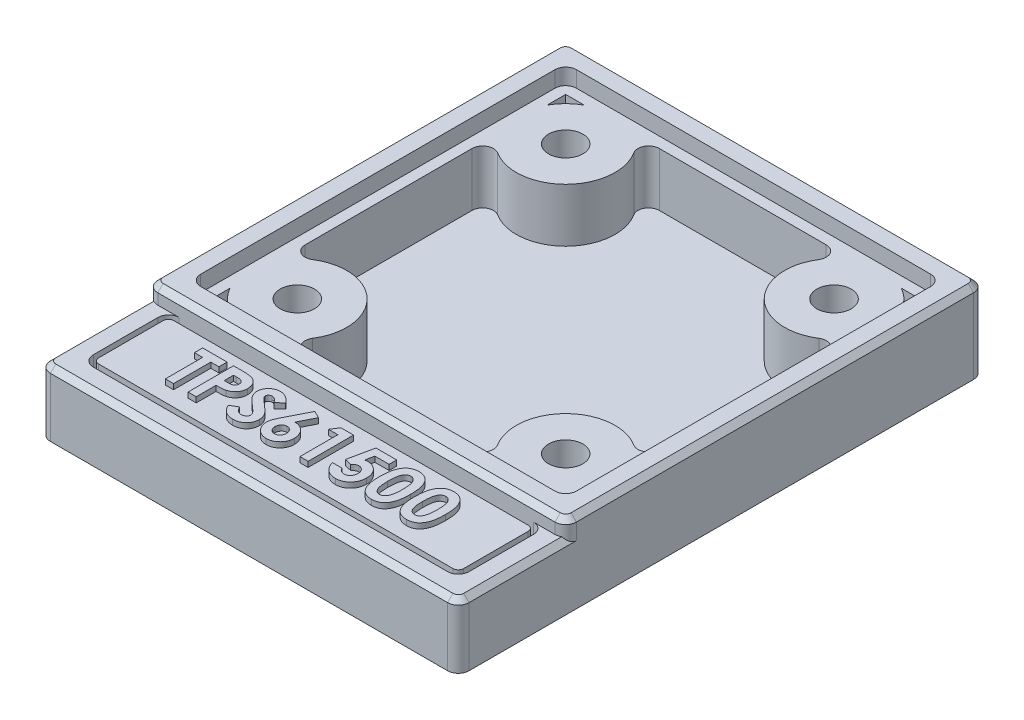
from build123d import *

# Parameters (mm, degrees)
SKETCH3_W           = 39
SKETCH3_H           = 39
SKETCH3_W_2         = 35
SKETCH3_H_2         = 35
SKETCH3_W_3         = 33
SKETCH3_H_3         = 33
SKETCH3_H_4         = 8
BOSS_EXTRUDE1_DEPTH = 1
BOSS_EXTRUDE2_START = 1
SKETCH3_3_W         = 39
SKETCH3_3_H         = 39
SKETCH3_3_W_2       = 35
SKETCH3_3_H_2       = 35
SKETCH3_3_W_3       = 33
SKETCH3_3_H_3       = 33
BOSS_EXTRUDE2_DEPTH = 5
BOSS_EXTRUDE3_START = 6
SKETCH3_4_W         = 39
SKETCH3_4_H         = 39
SKETCH3_4_W_2       = 35
SKETCH3_4_H_2       = 35
BOSS_EXTRUDE3_DEPTH = 1.5
SKETCH4_R           = 1.6
BOSS_EXTRUDE4_DEPTH = 5
FILLET1_R           = 1
CHAMFER1_SIZE       = 0.5
BOSS_EXTRUDE5_START = 0.5
BOSS_EXTRUDE5_DEPTH = 4.5
BOSS_EXTRUDE6_DEPTH = 0.5


with BuildPart() as part:
    # Sketch3 → Boss-Extrude1 (new body)
    # profile 1 of 5: a face of its own
    with BuildSketch(Plane(origin=(0, 0, 0), x_dir=(1, 0, 0), z_dir=(0, 1, 0))):
        Rectangle(SKETCH3_W, SKETCH3_H)
        Rectangle(SKETCH3_W_2, SKETCH3_H_2, mode=Mode.SUBTRACT)
    # profile 2 of 5: a face of its own
    with BuildSketch(Plane(origin=(0, 0, 0), x_dir=(1, 0, 0), z_dir=(0, 1, 0))):
        Rectangle(SKETCH3_W_2, SKETCH3_H_2)
        Rectangle(SKETCH3_W_3, SKETCH3_H_3, mode=Mode.SUBTRACT)
    # profile 3 of 5: a face of its own
    with BuildSketch(Plane(origin=(0, 0, 0), x_dir=(1, 0, 0), z_dir=(0, 1, 0))):
        Rectangle(SKETCH3_W_3, SKETCH3_H_3)
    # profile 4 of 5: a face of its own
    with BuildSketch(Plane(origin=(0, 0, 0), x_dir=(1, 0, 0), z_dir=(0, 1, 0))):
        Polygon((-17.5, -19.5), (-19.5, -19.5), (-19.5, -29.5), (19.5, -29.5), (19.5, -19.5), (17.5, -19.5), (17.5, -27.5), (-17.5, -27.5), align=None)
    # profile 5 of 5: a face of its own
    with BuildSketch(Plane(origin=(0, 0, 0), x_dir=(1, 0, 0), z_dir=(0, 1, 0))):
        with Locations((0, -23.5)):
            Rectangle(SKETCH3_W_2, SKETCH3_H_4)
    extrude(amount=BOSS_EXTRUDE1_DEPTH)

    # Sketch3<3> → Boss-Extrude2 (add)
    # profile 1 of 3: a face of its own
    with BuildSketch(Plane(origin=(0, 0, 0), x_dir=(1, 0, 0), z_dir=(0, 1, 0)).offset(BOSS_EXTRUDE2_START)):
        Polygon((-17.5, -19.5), (-19.5, -19.5), (-19.5, -29.5), (19.5, -29.5), (19.5, -19.5), (17.5, -19.5), (17.5, -27.5), (-17.5, -27.5), align=None)
    # profile 2 of 3: a face of its own
    with BuildSketch(Plane(origin=(0, 0, 0), x_dir=(1, 0, 0), z_dir=(0, 1, 0)).offset(BOSS_EXTRUDE2_START)):
        Rectangle(SKETCH3_3_W, SKETCH3_3_H)
        Rectangle(SKETCH3_3_W_2, SKETCH3_3_H_2, mode=Mode.SUBTRACT)
    # profile 3 of 3: a face of its own
    with BuildSketch(Plane(origin=(0, 0, 0), x_dir=(1, 0, 0), z_dir=(0, 1, 0)).offset(BOSS_EXTRUDE2_START)):
        Rectangle(SKETCH3_3_W_2, SKETCH3_3_H_2)
        Rectangle(SKETCH3_3_W_3, SKETCH3_3_H_3, mode=Mode.SUBTRACT)
    extrude(amount=BOSS_EXTRUDE2_DEPTH)

    # Sketch3<4> → Boss-Extrude3 (add)
    with BuildSketch(Plane(origin=(0, 0, 0), x_dir=(1, 0, 0), z_dir=(0, 1, 0)).offset(BOSS_EXTRUDE3_START)):
        Rectangle(SKETCH3_4_W, SKETCH3_4_H)
        Rectangle(SKETCH3_4_W_2, SKETCH3_4_H_2, mode=Mode.SUBTRACT)
    extrude(amount=BOSS_EXTRUDE3_DEPTH)

    # Sketch4 → Boss-Extrude4 (add)
    # profile 1 of 4: a face of its own
    with BuildSketch(Plane(origin=(0, 1, 0), x_dir=(1, 0, 0), z_dir=(0, 1, 0))):
        with BuildLine():
            ThreePointArc((-7.9, 12.5), (-8.524500575, 14.814174652), (-10.228436662, 16.5))
            Line((-10.228436662, 16.5), (-14.771563338, 16.5))
            ThreePointArc((-14.771563338, 16.5), (-15.752691193, 15.752691193), (-16.5, 14.771563338))
            Line((-16.5, 14.771563338), (-16.5, 10.228436662))
            ThreePointArc((-16.5, 10.228436662), (-11.325265988, 8.052528808), (-7.9, 12.5))
        make_face()
        with Locations(Location((-12.5, 12.5, 0), (0, 0, 90))):
            Circle(SKETCH4_R, mode=Mode.SUBTRACT)
    # profile 2 of 4: a face of its own
    with BuildSketch(Plane(origin=(0, 1, 0), x_dir=(1, 0, 0), z_dir=(0, 1, 0))):
        with BuildLine():
            ThreePointArc((16.5, 14.771563338), (15.752691193, 15.752691193), (14.771563338, 16.5))
            Line((14.771563338, 16.5), (10.228436662, 16.5))
            ThreePointArc((10.228436662, 16.5), (9.247308807, 9.247308807), (16.5, 10.228436662))
            Line((16.5, 10.228436662), (16.5, 14.771563338))
        make_face()
        with Locations(Location((12.5, 12.5, 0), (0, 0, 90))):
            Circle(SKETCH4_R, mode=Mode.SUBTRACT)
    # profile 3 of 4: a face of its own
    with BuildSketch(Plane(origin=(0, 1, 0), x_dir=(1, 0, 0), z_dir=(0, 1, 0))):
        with BuildLine():
            Line((16.5, -14.771563338), (16.5, -10.228436662))
            ThreePointArc((16.5, -10.228436662), (9.247308807, -9.247308807), (10.228436662, -16.5))
            Line((10.228436662, -16.5), (14.771563338, -16.5))
            ThreePointArc((14.771563338, -16.5), (15.752691193, -15.752691193), (16.5, -14.771563338))
        make_face()
        with Locations(Location((12.5, -12.5, 0), (0, 0, 90))):
            Circle(SKETCH4_R, mode=Mode.SUBTRACT)
    # profile 4 of 4: a face of its own
    with BuildSketch(Plane(origin=(0, 1, 0), x_dir=(1, 0, 0), z_dir=(0, 1, 0))):
        with BuildLine():
            Line((-14.771563338, -16.5), (-10.228436662, -16.5))
            ThreePointArc((-10.228436662, -16.5), (-8.524500575, -14.814174652), (-7.9, -12.5))
            ThreePointArc((-7.9, -12.5), (-11.325265988, -8.052528808), (-16.5, -10.228436662))
            Line((-16.5, -10.228436662), (-16.5, -14.771563338))
            ThreePointArc((-16.5, -14.771563338), (-15.752691193, -15.752691193), (-14.771563338, -16.5))
        make_face()
        with Locations(Location((-12.5, -12.5, 0), (0, 0, 90))):
            Circle(SKETCH4_R, mode=Mode.SUBTRACT)
    extrude(amount=BOSS_EXTRUDE4_DEPTH)

    # Fillet1
    fillet1_edges = [part.edges().sort_by_distance(p)[0] for p in [
        (19.5, 3.75, -19.5),
        (10.228436662, 3.5, -16.5),
        (16.5, 3.5, -10.228436662),
        (16.5, 3.5, 10.228436662),
        (10.228436662, 3.5, 16.5),
        (-16.5, 3.5, 10.228436662),
        (-10.228436662, 3.5, 16.5),
        (17.5, 3.5, 19.5),
        (-17.5, 3.5, 19.5),
        (-17.5, 3.5, 27.5),
        (17.5, 3.5, 27.5),
        (19.5, 6.75, 19.5),
        (-19.5, 6.75, 19.5),
        (17.5, 6.75, -17.5),
        (-17.5, 6.75, -17.5),
        (-17.5, 6.75, 17.5),
        (17.5, 6.75, 17.5),
        (-16.5, 3.5, -10.228436662),
        (-10.228436662, 3.5, -16.5),
        (19.5, 3, 29.5),
        (-19.5, 3, 29.5),
        (-19.5, 3.75, -19.5),
    ]]
    fillet(fillet1_edges, radius=FILLET1_R)

    # Chamfer1
    chamfer1_edges = [part.edges().sort_by_distance(p)[0] for p in [
        (0, 7.5, 19.5),
        (19.5, 7.5, 0),
        (0, 6, 29.5),
        (-19.5, 6, 23.5),
        (-19.207106781, 6, 29.207106781),
        (19.207106781, 6, 29.207106781),
        (-19.5, 7.5, 0),
        (0, 7.5, -19.5),
        (19.207106781, 7.5, -19.207106781),
        (-19.207106781, 7.5, -19.207106781),
        (-19.207106781, 7.5, 19.207106781),
        (19.207106781, 7.5, 19.207106781),
        (19.5, 6, 23.5),
    ]]
    chamfer(chamfer1_edges, length=CHAMFER1_SIZE)


with BuildPart() as body_2:
    # Sketch5 → Boss-Extrude5 (new body)
    with BuildSketch(Plane(origin=(0, 1, 0), x_dir=(1, 0, 0), z_dir=(0, 1, 0)).offset(BOSS_EXTRUDE5_START)):
        with BuildLine():
            Line((-17, -20.5), (-17, -26.5))
            ThreePointArc((-17, -26.5), (-16.853553391, -26.853553391), (-16.5, -27))
            Line((-16.5, -27), (16.5, -27))
            ThreePointArc((16.5, -27), (16.853553391, -26.853553391), (17, -26.5))
            Line((17, -26.5), (17, -20.5))
            ThreePointArc((17, -20.5), (16.853553391, -20.146446609), (16.5, -20))
            Line((16.5, -20), (-16.5, -20))
            ThreePointArc((-16.5, -20), (-16.853553391, -20.146446609), (-17, -20.5))
        make_face()
    extrude(amount=BOSS_EXTRUDE5_DEPTH)

    # Sketch6 → Boss-Extrude6 (add)
    # profile 1 of 8: a face of its own
    with BuildSketch(Plane(origin=(0, 6, 0), x_dir=(1, 0, 0), z_dir=(0, 1, 0))):
        Polygon((-12.455769231, -21.362535969), (-10.176282051, -21.362535969), (-10.176282051, -22.122365029), (-10.936111111, -22.122365029), (-10.936111111, -25.595869302), (-11.695940171, -25.595869302), (-11.695940171, -22.122365029), (-12.455769231, -22.122365029), align=None)
    # profile 2 of 8: a face of its own
    with BuildSketch(Plane(origin=(0, 6, 0), x_dir=(1, 0, 0), z_dir=(0, 1, 0))):
        with BuildLine():
            Line((-9.579273504, -21.362535969), (-8.73125, -21.362535969))
            add(Edge.make_bspline(
                [(-8.73125, -21.362535969), (-8.675841244, -21.36278399), (-8.56894614, -21.363262476), (-8.414794606, -21.369064746), (-8.272582267, -21.379462767), (-8.142341798, -21.392313077), (-8.02412675, -21.410328711), (-7.917789082, -21.430982225), (-7.823306727, -21.456144217), (-7.739614256, -21.486011152), (-7.664502966, -21.521223102), (-7.59342346, -21.558726342), (-7.527982143, -21.603485136), (-7.464875994, -21.650675571), (-7.407712899, -21.704805733), (-7.352926684, -21.762273179), (-7.302837694, -21.825357021), (-7.257213834, -21.893293647), (-7.215825964, -21.964827879), (-7.179666751, -22.040087597), (-7.150336423, -22.119191894), (-7.125731925, -22.201629053), (-7.105969352, -22.287395483), (-7.092814754, -22.377018654), (-7.08387949, -22.469872783), (-7.083091076, -22.533069362), (-7.082692308, -22.565033298)],
                knots=[0, 0, 0, 0, 1.698747864, 3.27724071, 4.728299578, 6.070144658, 7.288476769, 8.393259625, 9.389771311, 10.283485332, 11.113357557, 11.931608583, 12.74405601, 13.541433047, 14.344816069, 15.154114104, 15.974336324, 16.810834471, 17.661136416, 18.50621059, 19.367396281, 20.244825668, 21.142564693, 22.063065223, 23.020325768, 24, 24, 24, 24], degree=3))
            add(Edge.make_bspline(
                [(-7.082692308, -22.565033298), (-7.083269276, -22.60039424), (-7.084403089, -22.669882836), (-7.095518112, -22.771744592), (-7.114506084, -22.868860554), (-7.13932237, -22.962049719), (-7.173926916, -23.049778917), (-7.213460985, -23.134141395), (-7.262100429, -23.212771887), (-7.31767877, -23.286653966), (-7.378376659, -23.356388329), (-7.445635061, -23.419961528), (-7.518172003, -23.477806939), (-7.595567593, -23.530530786), (-7.678112398, -23.578026713), (-7.765746859, -23.62073947), (-7.859069392, -23.657302971), (-7.924056396, -23.676425385), (-7.957004541, -23.686120371)],
                knots=[0, 0, 0, 0, 1.102006807, 2.165578795, 3.188629044, 4.184801286, 5.166646146, 6.124351954, 7.085497154, 8.042432466, 9.003981491, 9.963833307, 10.922997304, 11.89326795, 12.880200226, 13.889073926, 14.929769137, 16, 16, 16, 16], degree=3))
            add(Edge.make_bspline(
                [(-7.957004541, -23.686120371), (-7.978706084, -23.69151975), (-8.025718615, -23.703216544), (-8.103511442, -23.715091725), (-8.193159507, -23.726010225), (-8.2949527, -23.735393353), (-8.40894971, -23.741771694), (-8.535040155, -23.746752894), (-8.673281179, -23.750374742), (-8.76940852, -23.750503261), (-8.819444444, -23.750570157)],
                knots=[0, 0, 0, 0, 0.618981996, 1.340914327, 2.176866532, 3.120127938, 4.170906482, 5.338178032, 6.614476169, 8, 8, 8, 8], degree=3))
            Line((-8.819444444, -23.750570157), (-8.819444444, -25.595869302))
            Line((-8.819444444, -25.595869302), (-9.579273504, -25.595869302))
            Line((-9.579273504, -25.595869302), (-9.579273504, -21.362535969))
        make_face()
        with BuildLine():
            Line((-8.819444444, -22.990741097), (-8.550620994, -22.990741097))
            add(Edge.make_bspline(
                [(-8.550620994, -22.990741097), (-8.501704323, -22.990430928), (-8.411696921, -22.989860211), (-8.288778596, -22.981607314), (-8.189999065, -22.969003474), (-8.111961401, -22.950926653), (-8.050343274, -22.923492683), (-7.997201497, -22.891756746), (-7.951620438, -22.851627525), (-7.91215395, -22.805773024), (-7.880601683, -22.753083903), (-7.858721828, -22.694418104), (-7.844509105, -22.631008257), (-7.843196428, -22.5868792), (-7.842521368, -22.564185275)],
                knots=[0, 0, 0, 0, 1.8619151, 3.425951444, 4.686033666, 5.651700536, 6.461346321, 7.243864085, 7.999046032, 8.762387399, 9.539336099, 10.322741239, 11.137448474, 12, 12, 12, 12], degree=3))
            add(Edge.make_bspline(
                [(-7.842521368, -22.564185275), (-7.843189484, -22.544357888), (-7.844485792, -22.50588799), (-7.854008818, -22.450366385), (-7.869185782, -22.398608795), (-7.89117662, -22.351155761), (-7.919605566, -22.308087912), (-7.954266204, -22.269422214), (-7.994713771, -22.234330609), (-8.025941657, -22.215756087), (-8.041806891, -22.206319356)],
                knots=[0, 0, 0, 0, 1.102301479, 2.1387299, 3.123554645, 4.094223062, 5.036071848, 5.982632524, 6.975082478, 8, 8, 8, 8], degree=3))
            add(Edge.make_bspline(
                [(-8.041806891, -22.206319356), (-8.05524566, -22.199522985), (-8.083698289, -22.185133675), (-8.132155873, -22.16840505), (-8.188075186, -22.154292612), (-8.251833746, -22.142579424), (-8.3231772, -22.133488774), (-8.402092821, -22.126536702), (-8.48869674, -22.123741002), (-8.548924584, -22.122836337), (-8.580301816, -22.122365029)],
                knots=[0, 0, 0, 0, 0.656809284, 1.390599849, 2.23162475, 3.173112763, 4.218524733, 5.370385145, 6.63003504, 8, 8, 8, 8], degree=3))
            Line((-8.580301816, -22.122365029), (-8.819444444, -22.122365029))
            Line((-8.819444444, -22.122365029), (-8.819444444, -22.990741097))
        make_face(mode=Mode.SUBTRACT)
    # profile 3 of 8: a face of its own
    with BuildSketch(Plane(origin=(0, 6, 0), x_dir=(1, 0, 0), z_dir=(0, 1, 0))):
        with BuildLine():
            Line((-4.151923077, -21.928167646), (-4.720098825, -22.448006055))
            add(Edge.make_bspline(
                [(-4.720098825, -22.448006055), (-4.744437038, -22.413674475), (-4.791163012, -22.347762631), (-4.866900943, -22.259505117), (-4.942296878, -22.18421489), (-5.018049315, -22.122206477), (-5.094829695, -22.073856626), (-5.172504738, -22.039624397), (-5.250634083, -22.017862645), (-5.303124942, -22.015152783), (-5.328979701, -22.01381802)],
                knots=[0, 0, 0, 0, 1.299362458, 2.494594718, 3.587462134, 4.587049575, 5.512617175, 6.380583204, 7.202344345, 8, 8, 8, 8], degree=3))
            add(Edge.make_bspline(
                [(-5.328979701, -22.01381802), (-5.353096278, -22.014663787), (-5.399659053, -22.01629674), (-5.466037743, -22.032528173), (-5.524969689, -22.060541244), (-5.576397377, -22.09717069), (-5.617135693, -22.14130068), (-5.649662079, -22.187581693), (-5.667977168, -22.238665464), (-5.670387794, -22.273751859), (-5.671581197, -22.291121706)],
                knots=[0, 0, 0, 0, 1.185010067, 2.2879431, 3.333075148, 4.379039566, 5.372662701, 6.27520591, 7.14612461, 8, 8, 8, 8], degree=3))
            add(Edge.make_bspline(
                [(-5.671581197, -22.291121706), (-5.670833351, -22.308742034), (-5.669327295, -22.344226926), (-5.654780844, -22.396234453), (-5.632855188, -22.447051862), (-5.611904328, -22.477986837), (-5.601195246, -22.493799324)],
                knots=[0, 0, 0, 0, 0.967525499, 1.948461899, 2.951351359, 4, 4, 4, 4], degree=3))
            add(Edge.make_bspline(
                [(-5.601195246, -22.493799324), (-5.591459531, -22.506090204), (-5.569049203, -22.534382188), (-5.526317296, -22.579192281), (-5.472654996, -22.634088566), (-5.405997264, -22.697183322), (-5.329111245, -22.770745683), (-5.238433174, -22.851883885), (-5.136573161, -22.943110682), (-5.064173424, -23.006637721), (-5.02623531, -23.039926461)],
                knots=[0, 0, 0, 0, 0.473873513, 1.090794244, 1.870441696, 2.795289791, 3.865433203, 5.087734844, 6.473946851, 8, 8, 8, 8], degree=3))
            add(Edge.make_bspline(
                [(-5.02623531, -23.039926461), (-4.990624933, -23.070745446), (-4.923043835, -23.129233477), (-4.826889353, -23.212247847), (-4.742385578, -23.286933851), (-4.668301483, -23.352170612), (-4.605760109, -23.408642614), (-4.554498534, -23.456619792), (-4.513890683, -23.495168119), (-4.490807498, -23.518451331), (-4.480956197, -23.528387999)],
                knots=[0, 0, 0, 0, 1.543621617, 2.929473131, 4.163658386, 5.240097082, 6.164993805, 6.925417477, 7.541396219, 8, 8, 8, 8], degree=3))
            add(Edge.make_bspline(
                [(-4.480956197, -23.528387999), (-4.443582413, -23.568834437), (-4.371736877, -23.646586694), (-4.278363007, -23.76707824), (-4.201513292, -23.884702558), (-4.142060895, -24.00167294), (-4.097160053, -24.119677035), (-4.065504365, -24.241608889), (-4.046545563, -24.368742611), (-4.044440694, -24.455495857), (-4.043376068, -24.499374911)],
                knots=[0, 0, 0, 0, 1.206664779, 2.319633467, 3.337109185, 4.282041471, 5.190008762, 6.099243693, 7.03861361, 8, 8, 8, 8], degree=3))
            add(Edge.make_bspline(
                [(-4.043376068, -24.499374911), (-4.044133841, -24.542129669), (-4.04562062, -24.626016094), (-4.063830809, -24.748771382), (-4.089797469, -24.86625352), (-4.12994648, -24.977184137), (-4.178879858, -25.083384124), (-4.240224914, -25.183199224), (-4.312266271, -25.277639607), (-4.394836728, -25.365017034), (-4.486169457, -25.444305993), (-4.58413249, -25.514890897), (-4.689683758, -25.573167726), (-4.801921446, -25.621154538), (-4.920785479, -25.658114622), (-5.046134251, -25.685431569), (-5.178159493, -25.70182677), (-5.268440256, -25.703540694), (-5.314563301, -25.704416311)],
                knots=[0, 0, 0, 0, 1.043214005, 2.046824704, 3.02475056, 3.976699089, 4.921714032, 5.875962561, 6.831408892, 7.817874052, 8.806269674, 9.781291748, 10.760897367, 11.74438705, 12.757449933, 13.795994037, 14.874007457, 16, 16, 16, 16], degree=3))
            add(Edge.make_bspline(
                [(-5.314563301, -25.704416311), (-5.350769499, -25.703773989), (-5.422478534, -25.702501823), (-5.528166811, -25.692115646), (-5.63022079, -25.675353461), (-5.728525516, -25.651328243), (-5.823523869, -25.620885034), (-5.915219751, -25.58369982), (-6.002980155, -25.539196244), (-6.087469117, -25.488289477), (-6.168275917, -25.429180016), (-6.246422324, -25.363076332), (-6.321132116, -25.288961723), (-6.392764108, -25.207011467), (-6.460859977, -25.116993499), (-6.527648747, -25.020161487), (-6.590162124, -24.914718361), (-6.628779417, -24.840749154), (-6.648504274, -24.802967326)],
                knots=[0, 0, 0, 0, 1.016823716, 2.013894106, 2.979844003, 3.91962641, 4.853723003, 5.779685073, 6.695824784, 7.614987388, 8.547259901, 9.504950863, 10.487499108, 11.500346958, 12.559593716, 13.656357062, 14.802919212, 16, 16, 16, 16], degree=3))
            Line((-6.648504274, -24.802967326), (-5.980261752, -24.401852208))
            add(Edge.make_bspline(
                [(-5.980261752, -24.401852208), (-5.955588905, -24.44473952), (-5.908288948, -24.526958163), (-5.82813475, -24.637429329), (-5.746020865, -24.732029597), (-5.660048896, -24.8090869), (-5.571264228, -24.869631594), (-5.479238011, -24.912901033), (-5.383905589, -24.939684766), (-5.318969474, -24.942955679), (-5.286578526, -24.944587251)],
                knots=[0, 0, 0, 0, 1.283663364, 2.460892379, 3.537111102, 4.529833553, 5.449777664, 6.316464042, 7.160231139, 8, 8, 8, 8], degree=3))
            add(Edge.make_bspline(
                [(-5.286578526, -24.944587251), (-5.253632293, -24.943254821), (-5.189711804, -24.940669712), (-5.098473486, -24.916791841), (-5.014822741, -24.879301831), (-4.942515655, -24.825808757), (-4.881290573, -24.764069619), (-4.836102949, -24.695382006), (-4.807715778, -24.621063666), (-4.804714566, -24.569437258), (-4.803205128, -24.543472134)],
                knots=[0, 0, 0, 0, 1.13588714, 2.203786484, 3.234766741, 4.283437687, 5.291419208, 6.222934724, 7.106237994, 8, 8, 8, 8], degree=3))
            add(Edge.make_bspline(
                [(-4.803205128, -24.543472134), (-4.804599032, -24.51931581), (-4.807430615, -24.470244552), (-4.828287179, -24.397283482), (-4.86089235, -24.324355594), (-4.899466566, -24.264538166), (-4.938720661, -24.214454656), (-4.97625643, -24.171059559), (-5.021965068, -24.123115575), (-5.075730676, -24.070562393), (-5.136842872, -24.012937374), (-5.205353134, -23.950246161), (-5.282045978, -23.883040988), (-5.336252631, -23.837261488), (-5.364596688, -23.813323896)],
                knots=[0, 0, 0, 0, 0.916159276, 1.861089862, 2.860218735, 3.940849679, 4.552606315, 5.27541173, 6.11797699, 7.06649574, 8.129236253, 9.306560635, 10.591630461, 12, 12, 12, 12], degree=3))
            add(Edge.make_bspline(
                [(-5.364596688, -23.813323896), (-5.418479869, -23.767733559), (-5.521898002, -23.680231901), (-5.668040944, -23.550994708), (-5.799728821, -23.430210708), (-5.915824234, -23.316386749), (-6.017806419, -23.211624895), (-6.104984707, -23.115074229), (-6.176401406, -23.025989996), (-6.251552082, -22.920475683), (-6.322960249, -22.791899243), (-6.38467717, -22.637206881), (-6.424716503, -22.482534146), (-6.429202354, -22.378695392), (-6.431410256, -22.327586717)],
                knots=[0, 0, 0, 0, 1.345494975, 2.582412109, 3.71882943, 4.751509156, 5.681369928, 6.505683931, 7.230279997, 7.856715994, 8.973648664, 10.023341002, 11.027102913, 12, 12, 12, 12], degree=3))
            add(Edge.make_bspline(
                [(-6.431410256, -22.327586717), (-6.430491993, -22.291343188), (-6.428682914, -22.219939543), (-6.412545656, -22.114950886), (-6.38842791, -22.013645654), (-6.353402018, -21.916393454), (-6.307942639, -21.823316098), (-6.252733989, -21.733957934), (-6.186918783, -21.649141394), (-6.112749489, -21.568922705), (-6.031033916, -21.495611953), (-5.943710442, -21.430907868), (-5.851273325, -21.376257857), (-5.754288049, -21.330921704), (-5.652153636, -21.29621976), (-5.545622506, -21.271621291), (-5.43454186, -21.256990907), (-5.358987202, -21.255002076), (-5.320499466, -21.253988961)],
                knots=[0, 0, 0, 0, 1.010766082, 1.991317756, 2.957454644, 3.913069143, 4.869106762, 5.843196583, 6.838735724, 7.860187025, 8.887984031, 9.89767229, 10.887916223, 11.879572884, 12.879850636, 13.892031539, 14.926195476, 16, 16, 16, 16], degree=3))
            add(Edge.make_bspline(
                [(-5.320499466, -21.253988961), (-5.270621265, -21.255813611), (-5.171258584, -21.25944851), (-5.024347995, -21.287872229), (-4.880851874, -21.332571521), (-4.76522001, -21.386496299), (-4.673213894, -21.438733257), (-4.602699801, -21.486826468), (-4.530947916, -21.541919826), (-4.457379604, -21.604186944), (-4.383361879, -21.674801018), (-4.306790062, -21.752081022), (-4.228707539, -21.836694839), (-4.177966279, -21.897142557), (-4.151923077, -21.928167646)],
                knots=[0, 0, 0, 0, 1.282922637, 2.555718331, 3.837320111, 5.142675274, 5.830281639, 6.55870424, 7.337177975, 8.157850921, 9.037902056, 9.96903443, 10.957596896, 12, 12, 12, 12], degree=3))
        make_face()
    # profile 4 of 8: a face of its own
    with BuildSketch(Plane(origin=(0, 6, 0), x_dir=(1, 0, 0), z_dir=(0, 1, 0))):
        with BuildLine():
            Line((-2.106490385, -21.253988961), (-1.433159722, -21.595742433))
            Line((-1.433159722, -21.595742433), (-2.170940171, -23.045014602))
            add(Edge.make_bspline(
                [(-2.170940171, -23.045014602), (-2.127350474, -23.04612573), (-2.041773351, -23.048307143), (-1.915766598, -23.066432132), (-1.795273699, -23.097379039), (-1.678853937, -23.138555223), (-1.568193437, -23.19383825), (-1.461512183, -23.259604436), (-1.361569476, -23.339812215), (-1.266073879, -23.428678476), (-1.179240214, -23.527129439), (-1.103809827, -23.632918147), (-1.038073576, -23.743470724), (-0.98697286, -23.861260505), (-0.945753321, -23.984334988), (-0.916011609, -24.113186156), (-0.899043131, -24.248187134), (-0.896703743, -24.339899413), (-0.895512821, -24.386587785)],
                knots=[0, 0, 0, 0, 1.013672955, 1.990085268, 2.953345895, 3.903887042, 4.856677135, 5.825509993, 6.813434118, 7.832212698, 8.85718992, 9.860832204, 10.8510077, 11.84312444, 12.841215551, 13.86684641, 14.914066156, 16, 16, 16, 16], degree=3))
            add(Edge.make_bspline(
                [(-0.895512821, -24.386587785), (-0.896628813, -24.431592544), (-0.898834653, -24.520547652), (-0.917068835, -24.651200083), (-0.946536231, -24.77655345), (-0.988651057, -24.896357406), (-1.042182407, -25.011197558), (-1.107647622, -25.121006514), (-1.185589609, -25.224963711), (-1.273994563, -25.322516767), (-1.370636428, -25.4114371), (-1.472502218, -25.490474666), (-1.58045513, -25.555762695), (-1.692454728, -25.610899966), (-1.810562994, -25.652044314), (-1.93301243, -25.68310117), (-2.060731607, -25.701022324), (-2.147424113, -25.703275929), (-2.191292735, -25.704416311)],
                knots=[0, 0, 0, 0, 1.049934834, 2.075270938, 3.072134561, 4.05064612, 5.033440221, 6.024524368, 7.028587226, 8.060776465, 9.092543989, 10.090062252, 11.064205434, 12.031961459, 12.998029633, 13.977230324, 14.976426867, 16, 16, 16, 16], degree=3))
            add(Edge.make_bspline(
                [(-2.191292735, -25.704416311), (-2.237165983, -25.70348046), (-2.327369518, -25.701640236), (-2.459359865, -25.681034575), (-2.585949968, -25.650015624), (-2.70642837, -25.605725833), (-2.821544289, -25.549331186), (-2.929942444, -25.479548481), (-3.032535939, -25.397147237), (-3.128230977, -25.30398135), (-3.214445075, -25.201930867), (-3.291340844, -25.095975897), (-3.356394765, -24.985950172), (-3.409054397, -24.871971332), (-3.450140663, -24.754402573), (-3.478728324, -24.633020762), (-3.497355824, -24.508147862), (-3.499539473, -24.423402046), (-3.500641026, -24.380651621)],
                knots=[0, 0, 0, 0, 1.063775006, 2.091769615, 3.092589432, 4.084662827, 5.064601646, 6.061867366, 7.070035304, 8.113879863, 9.156342271, 10.166834137, 11.149076039, 12.117706134, 13.076241869, 14.034148791, 15.008317125, 16, 16, 16, 16], degree=3))
            add(Edge.make_bspline(
                [(-3.500641026, -24.380651621), (-3.500058987, -24.347546418), (-3.49889167, -24.281151734), (-3.487160833, -24.181729304), (-3.469325839, -24.082045899), (-3.448652746, -23.997929886), (-3.427365684, -23.926800993), (-3.405940092, -23.866606534), (-3.379387792, -23.799803846), (-3.34903458, -23.726222342), (-3.313925958, -23.645950542), (-3.274245326, -23.559207244), (-3.229893899, -23.465335564), (-3.198265223, -23.400860255), (-3.181784188, -23.367263533)],
                knots=[0, 0, 0, 0, 1.110454016, 2.227089276, 3.35462975, 4.507227546, 5.131400587, 5.845402449, 6.650387134, 7.543487832, 8.516250726, 9.590168902, 10.744287919, 12, 12, 12, 12], degree=3))
            Line((-3.181784188, -23.367263533), (-2.106490385, -21.253988961))
        make_face()
        with BuildLine():
            add(Edge.make_bspline(
                [(-2.208253205, -23.750570157), (-2.244712116, -23.75224245), (-2.316057419, -23.755514909), (-2.41749977, -23.789785685), (-2.509992178, -23.843548004), (-2.590165741, -23.918422429), (-2.65722355, -24.007900309), (-2.70649998, -24.109961782), (-2.736142492, -24.223244866), (-2.739222159, -24.30245051), (-2.740811966, -24.343338587)],
                knots=[0, 0, 0, 0, 0.981744412, 1.921144944, 2.858899012, 3.85339082, 4.86292663, 5.863643845, 6.897155691, 8, 8, 8, 8], degree=3))
            add(Edge.make_bspline(
                [(-2.740811966, -24.343338587), (-2.738929585, -24.384240279), (-2.735268228, -24.463796805), (-2.704511119, -24.578158546), (-2.654152189, -24.682537717), (-2.583527, -24.773201372), (-2.500614043, -24.848459226), (-2.408673408, -24.904116007), (-2.309238698, -24.938307794), (-2.24045728, -24.942479645), (-2.205709135, -24.944587251)],
                knots=[0, 0, 0, 0, 1.098279937, 2.136227893, 3.159405121, 4.194678092, 5.206500211, 6.154139736, 7.067477469, 8, 8, 8, 8], degree=3))
            add(Edge.make_bspline(
                [(-2.205709135, -24.944587251), (-2.169011165, -24.942442107), (-2.097040074, -24.938235108), (-1.993217054, -24.905482049), (-1.898374102, -24.850757701), (-1.814514587, -24.775740793), (-1.742480857, -24.686111731), (-1.692640793, -24.581119452), (-1.660461769, -24.465932288), (-1.657086774, -24.38511937), (-1.65534188, -24.343338587)],
                knots=[0, 0, 0, 0, 0.96921794, 1.900804717, 2.848419905, 3.844199796, 4.861108892, 5.867439427, 6.897452859, 8, 8, 8, 8], degree=3))
            add(Edge.make_bspline(
                [(-1.65534188, -24.343338587), (-1.657329633, -24.302474384), (-1.661179148, -24.223336085), (-1.690093565, -24.109522295), (-1.741718305, -24.007854205), (-1.81029335, -23.918053079), (-1.893226062, -23.84321204), (-1.989420205, -23.789361698), (-2.095496612, -23.755575625), (-2.170119674, -23.752262973), (-2.208253205, -23.750570157)],
                knots=[0, 0, 0, 0, 1.083229974, 2.097801324, 3.086792542, 4.086858909, 5.079819718, 6.026392613, 6.991456328, 8, 8, 8, 8], degree=3))
        make_face(mode=Mode.SUBTRACT)
    # profile 5 of 8: a face of its own
    with BuildSketch(Plane(origin=(0, 6, 0), x_dir=(1, 0, 0), z_dir=(0, 1, 0))):
        Polygon((0.426555823, -21.362535969), (1.601068376, -21.362535969), (1.601068376, -25.595869302), (0.841239316, -25.595869302), (0.841239316, -22.068091525), (-0.027136752, -22.068091525), align=None)
    # profile 6 of 8: a face of its own
    with BuildSketch(Plane(origin=(0, 6, 0), x_dir=(1, 0, 0), z_dir=(0, 1, 0))):
        with BuildLine():
            Line((3.689750267, -21.362535969), (5.617307692, -21.362535969))
            Line((5.617307692, -21.362535969), (5.617307692, -22.068091525))
            Line((5.617307692, -22.068091525), (4.291846955, -22.068091525))
            Line((4.291846955, -22.068091525), (4.126482372, -22.868625713))
            add(Edge.make_bspline(
                [(4.126482372, -22.868625713), (4.149015663, -22.862349906), (4.193455944, -22.849972727), (4.260405282, -22.837559983), (4.325288521, -22.829514436), (4.367864506, -22.828441267), (4.388521635, -22.827920584)],
                knots=[0, 0, 0, 0, 1.05461699, 2.079921384, 3.068411212, 4, 4, 4, 4], degree=3))
            add(Edge.make_bspline(
                [(4.388521635, -22.827920584), (4.433535681, -22.828952055), (4.522268284, -22.830985311), (4.652072821, -22.850287544), (4.776368334, -22.880687977), (4.894774464, -22.924045265), (5.007175544, -22.980475895), (5.113707827, -23.04874114), (5.214502063, -23.128960897), (5.307767722, -23.22118539), (5.393464105, -23.322449972), (5.467972223, -23.431978332), (5.531606805, -23.548208703), (5.582219552, -23.67186357), (5.622167447, -23.802166297), (5.651034687, -23.939200386), (5.668105329, -24.083128243), (5.6704072, -24.18131993), (5.671581197, -24.231399484)],
                knots=[0, 0, 0, 0, 1.01440847, 1.999622559, 2.951875003, 3.895578053, 4.836219714, 5.782137149, 6.743708247, 7.735272588, 8.734977101, 9.730283169, 10.717124674, 11.717316708, 12.737475749, 13.78628267, 14.87096371, 16, 16, 16, 16], degree=3))
            add(Edge.make_bspline(
                [(5.671581197, -24.231399484), (5.670146554, -24.282047557), (5.667315585, -24.381991011), (5.648846106, -24.528943241), (5.616247143, -24.669690302), (5.571469207, -24.804608971), (5.512477142, -24.932707628), (5.441531109, -25.055313279), (5.357431604, -25.171515863), (5.26100393, -25.280124161), (5.1561744, -25.37939423), (5.044555696, -25.4667223), (4.926931973, -25.540208164), (4.803300393, -25.599597165), (4.674370271, -25.646584686), (4.540102474, -25.680789358), (4.399844477, -25.700403837), (4.304627521, -25.703064122), (4.256229968, -25.704416311)],
                knots=[0, 0, 0, 0, 1.06808661, 2.107647099, 3.116961351, 4.110378221, 5.100014249, 6.085620622, 7.093190682, 8.119403071, 9.144090782, 10.133780668, 11.103064255, 12.062861538, 13.020824475, 13.992378307, 14.979551724, 16, 16, 16, 16], degree=3))
            add(Edge.make_bspline(
                [(4.256229968, -25.704416311), (4.212949476, -25.703310136), (4.12759129, -25.701128529), (4.001862428, -25.687719219), (3.880645844, -25.664011433), (3.764585064, -25.629700128), (3.652458936, -25.587470745), (3.545563668, -25.53465492), (3.443311855, -25.472258339), (3.345993851, -25.401419741), (3.255190937, -25.321622807), (3.172315658, -25.234271314), (3.096866278, -25.140466286), (3.030457295, -25.039050452), (2.97329688, -24.93017365), (2.922605859, -24.815119017), (2.88111475, -24.692685016), (2.860059207, -24.607806965), (2.849358974, -24.564672721)],
                knots=[0, 0, 0, 0, 1.054957082, 2.080596141, 3.077793124, 4.061112343, 5.027190972, 5.994718051, 6.962465889, 7.943658696, 8.924948258, 9.904494768, 10.875059, 11.855380583, 12.854004648, 13.869083016, 14.917087635, 16, 16, 16, 16], degree=3))
            Line((2.849358974, -24.564672721), (3.717735043, -24.564672721))
            add(Edge.make_bspline(
                [(3.717735043, -24.564672721), (3.733608978, -24.594562995), (3.76445816, -24.652651332), (3.823140125, -24.729772327), (3.888830858, -24.795537799), (3.960937795, -24.850590289), (4.039928143, -24.891834678), (4.122583195, -24.923112515), (4.20994131, -24.941186818), (4.269436044, -24.943446285), (4.299479167, -24.944587251)],
                knots=[0, 0, 0, 0, 1.104910296, 2.147267069, 3.153527244, 4.136738762, 5.099945312, 6.05603338, 7.018353, 8, 8, 8, 8], degree=3))
            add(Edge.make_bspline(
                [(4.299479167, -24.944587251), (4.32041882, -24.943799404), (4.36161794, -24.942249303), (4.42231833, -24.934048876), (4.480259518, -24.918517453), (4.535872285, -24.897010043), (4.589306019, -24.870187873), (4.63979473, -24.836326632), (4.688216831, -24.797351087), (4.733835141, -24.752626518), (4.77515218, -24.702769027), (4.811382704, -24.649193753), (4.843777789, -24.593091152), (4.867773324, -24.532238859), (4.887423638, -24.468453943), (4.901894924, -24.401255257), (4.910543149, -24.330564318), (4.911343743, -24.282305595), (4.911752137, -24.257688213)],
                knots=[0, 0, 0, 0, 0.978869489, 1.925942215, 2.855067702, 3.774946051, 4.70828698, 5.642468714, 6.60995405, 7.609372294, 8.622401667, 9.629904756, 10.629323, 11.642352373, 12.678539694, 13.745912462, 14.850161547, 16, 16, 16, 16], degree=3))
            add(Edge.make_bspline(
                [(4.911752137, -24.257688213), (4.911278149, -24.233642256), (4.910355521, -24.186836216), (4.902723354, -24.118108185), (4.889069556, -24.052897721), (4.870466138, -23.990705361), (4.846651542, -23.931908768), (4.817548515, -23.876157956), (4.783032724, -23.823734724), (4.742918861, -23.775706358), (4.700141851, -23.731653376), (4.654185597, -23.693124988), (4.60546414, -23.661149101), (4.55549144, -23.633233222), (4.502272765, -23.612916653), (4.447004791, -23.598925382), (4.389745639, -23.58865915), (4.350690414, -23.588055971), (4.330856036, -23.587749644)],
                knots=[0, 0, 0, 0, 1.166249705, 2.270133367, 3.348514167, 4.393962215, 5.415026464, 6.420877785, 7.440098956, 8.453121383, 9.451844239, 10.415694839, 11.355045125, 12.27538808, 13.187007209, 14.108269027, 15.039275622, 16, 16, 16, 16], degree=3))
            add(Edge.make_bspline(
                [(4.330856036, -23.587749644), (4.309311292, -23.588567148), (4.266131003, -23.5902056), (4.201975901, -23.603537247), (4.138594331, -23.625112853), (4.075633826, -23.65487982), (4.013719379, -23.693835389), (3.951217037, -23.739525804), (3.890218887, -23.795270908), (3.851434567, -23.836789989), (3.831370192, -23.858269142)],
                knots=[0, 0, 0, 0, 0.88288272, 1.769486374, 2.674910571, 3.623812639, 4.617874466, 5.670434592, 6.794841017, 8, 8, 8, 8], degree=3))
            Line((3.831370192, -23.858269142), (3.19196047, -23.711561076))
            Line((3.19196047, -23.711561076), (3.689750267, -21.362535969))
        make_face()
    # profile 7 of 8: a face of its own
    with BuildSketch(Plane(origin=(0, 6, 0), x_dir=(1, 0, 0), z_dir=(0, 1, 0))):
        with BuildLine():
            add(Edge.make_bspline(
                [(7.585570246, -21.253988961), (7.622349126, -21.254534953), (7.694666231, -21.255608521), (7.801175714, -21.267236135), (7.903773794, -21.284802217), (8.002861848, -21.309300775), (8.097726629, -21.341723745), (8.189058584, -21.380533483), (8.275770597, -21.427765642), (8.358968525, -21.481116791), (8.438620318, -21.541517855), (8.512811602, -21.610378186), (8.582897267, -21.686113306), (8.647360217, -21.769868194), (8.707628004, -21.86088101), (8.763502597, -21.959166185), (8.814556262, -22.065204761), (8.861361191, -22.179188092), (8.903214306, -22.302824739), (8.938467132, -22.437532868), (8.96870233, -22.583343241), (8.99422297, -22.740618804), (9.013512449, -22.909568612), (9.026513947, -23.090080424), (9.035436189, -23.28180624), (9.036164361, -23.413328575), (9.036538462, -23.480898683)],
                knots=[0, 0, 0, 0, 0.879237366, 1.728815576, 2.559023295, 3.367336655, 4.166867292, 4.954216142, 5.737608147, 6.525189134, 7.316157332, 8.124696809, 8.942788509, 9.781158001, 10.649253743, 11.551476218, 12.482711956, 13.461909668, 14.496590415, 15.601789533, 16.789733467, 18.056700938, 19.410929216, 20.8549011, 22.384193279, 24, 24, 24, 24], degree=3))
            add(Edge.make_bspline(
                [(9.036538462, -23.480898683), (9.03613416, -23.549314169), (9.035348608, -23.682244231), (9.026884847, -23.875723668), (9.01230985, -24.057546105), (8.993524541, -24.227692729), (8.967793808, -24.38607369), (8.937659542, -24.533099086), (8.90185026, -24.668715627), (8.858618517, -24.792617737), (8.8120969, -24.906801248), (8.76090358, -25.012633074), (8.705930851, -25.110399866), (8.64843962, -25.20157657), (8.585278006, -25.283475342), (8.519520265, -25.358881169), (8.448303185, -25.424921747), (8.374625282, -25.48500051), (8.295787436, -25.536920617), (8.212602681, -25.582329088), (8.123587977, -25.61916075), (8.030365911, -25.651194963), (7.931347493, -25.674192072), (7.828106113, -25.692439521), (7.719476197, -25.702524181), (7.645516574, -25.70377525), (7.607618857, -25.704416311)],
                knots=[0, 0, 0, 0, 1.643780988, 3.193836972, 4.651895693, 6.025988579, 7.305620092, 8.505800249, 9.631074763, 10.672816429, 11.65661981, 12.592235626, 13.49536222, 14.350718032, 15.179365177, 15.97804903, 16.751647189, 17.51006938, 18.259804725, 19.016521909, 19.783502495, 20.571750527, 21.382245291, 22.22305063, 23.089471752, 24, 24, 24, 24], degree=3))
            add(Edge.make_bspline(
                [(7.607618857, -25.704416311), (7.569722162, -25.703762884), (7.495483095, -25.702482831), (7.386559432, -25.692514505), (7.282770925, -25.674118151), (7.182969113, -25.651018409), (7.0878486, -25.619231629), (6.996953287, -25.58129799), (6.91098208, -25.536172846), (6.829696938, -25.484131769), (6.753375392, -25.424454978), (6.680831406, -25.357780784), (6.612225451, -25.284278188), (6.548601193, -25.203123901), (6.488916652, -25.115401162), (6.433794243, -25.020108222), (6.383267093, -24.917383823), (6.335754703, -24.80708478), (6.294472451, -24.686836479), (6.257733163, -24.55556512), (6.227637305, -24.412176446), (6.203432201, -24.256716524), (6.184106861, -24.089514701), (6.169731029, -23.910490274), (6.161220255, -23.719559858), (6.160442942, -23.588323873), (6.160042735, -23.520755787)],
                knots=[0, 0, 0, 0, 0.917216111, 1.796812873, 2.643793957, 3.46689424, 4.273913431, 5.068098542, 5.848489301, 6.620921603, 7.401012384, 8.190319798, 9.003608147, 9.831726257, 10.68377682, 11.569763213, 12.493818149, 13.453288342, 14.474581811, 15.568529029, 16.750744269, 18.018426408, 19.375425659, 20.823733699, 22.36466933, 24, 24, 24, 24], degree=3))
            add(Edge.make_bspline(
                [(6.160042735, -23.520755787), (6.160767673, -23.426875252), (6.162166449, -23.24573155), (6.179892771, -22.984031569), (6.205910515, -22.742135268), (6.244124419, -22.520447283), (6.291375382, -22.318146544), (6.3518827, -22.136565704), (6.420765881, -21.973192183), (6.479463201, -21.876408726), (6.507732372, -21.82979692)],
                knots=[0, 0, 0, 0, 1.288568992, 2.486310467, 3.599230591, 4.627010532, 5.572937695, 6.447898582, 7.252493626, 8, 8, 8, 8], degree=3))
            add(Edge.make_bspline(
                [(6.507732372, -21.82979692), (6.540602417, -21.784005496), (6.604869833, -21.694474238), (6.717243207, -21.576936433), (6.837973766, -21.476412346), (6.969541247, -21.395176928), (7.109864857, -21.331114671), (7.260149343, -21.28586822), (7.419839732, -21.25950553), (7.529501785, -21.255855277), (7.585570246, -21.253988961)],
                knots=[0, 0, 0, 0, 1.058512271, 2.069600068, 3.047294572, 4.004278952, 4.967380941, 5.939006123, 6.946246673, 8, 8, 8, 8], degree=3))
        make_face()
        with BuildLine():
            add(Edge.make_bspline(
                [(7.604226763, -22.01381802), (7.57097835, -22.015393929), (7.505793812, -22.018483547), (7.411207941, -22.04471004), (7.322019371, -22.085218274), (7.254176008, -22.133963599), (7.203395925, -22.180691839), (7.167915517, -22.222979377), (7.133700256, -22.270169221), (7.103479614, -22.324390808), (7.074943439, -22.38369589), (7.047054995, -22.448353678), (7.024193794, -22.519952306), (7.00173327, -22.597272441), (6.982055756, -22.68245178), (6.965570312, -22.776186569), (6.950842018, -22.879086374), (6.940568856, -22.991218595), (6.930991187, -23.112465914), (6.92412546, -23.243098423), (6.921255072, -23.383080879), (6.920342663, -23.47948472), (6.919871795, -23.529236022)],
                knots=[0, 0, 0, 0, 1.076674018, 2.110852608, 3.161083442, 4.239746716, 4.804137807, 5.395870207, 6.026861976, 6.692161227, 7.405688833, 8.16177676, 8.973626916, 9.841385931, 10.773283133, 11.807421078, 12.927755683, 14.143907515, 15.458935494, 16.872852025, 18.386167141, 20, 20, 20, 20], degree=3))
            add(Edge.make_bspline(
                [(6.919871795, -23.529236022), (6.920646787, -23.59369124), (6.922132893, -23.717288899), (6.92991642, -23.895026636), (6.945517853, -24.056782289), (6.964922885, -24.203652135), (6.992178046, -24.334683685), (7.023536873, -24.451116617), (7.062262236, -24.551466696), (7.107016854, -24.637185208), (7.156584611, -24.710105769), (7.210392591, -24.772088574), (7.266608826, -24.825762758), (7.326988007, -24.869361637), (7.391386088, -24.902773808), (7.459265463, -24.92680677), (7.530669268, -24.941518347), (7.579565858, -24.943558369), (7.604226763, -24.944587251)],
                knots=[0, 0, 0, 0, 1.771748488, 3.397459088, 4.888034009, 6.237357457, 7.467047327, 8.564189669, 9.548206622, 10.417051504, 11.216568818, 11.965764335, 12.669334354, 13.348544111, 14.005342236, 14.656555988, 15.322436492, 16, 16, 16, 16], degree=3))
            add(Edge.make_bspline(
                [(7.604226763, -24.944587251), (7.628041384, -24.943883214), (7.67466745, -24.942504796), (7.742658697, -24.928355526), (7.806956051, -24.905351885), (7.867365379, -24.872811621), (7.924102756, -24.831431695), (7.976890885, -24.781030269), (8.025331649, -24.721104955), (8.053553458, -24.67663151), (8.06809562, -24.653715189)],
                knots=[0, 0, 0, 0, 0.992283464, 1.942767638, 2.88273346, 3.832339453, 4.79467288, 5.803907806, 6.868395428, 8, 8, 8, 8], degree=3))
            add(Edge.make_bspline(
                [(8.06809562, -24.653715189), (8.085216566, -24.622400769), (8.121117802, -24.556736969), (8.162662774, -24.445931755), (8.197633017, -24.320961787), (8.227731393, -24.181438147), (8.248316846, -24.026810537), (8.266045013, -23.858059463), (8.274595749, -23.674335163), (8.275986572, -23.547050305), (8.276709402, -23.480898683)],
                knots=[0, 0, 0, 0, 0.710965849, 1.490837728, 2.352621235, 3.297892224, 4.334225155, 5.461620853, 6.680770821, 8, 8, 8, 8], degree=3))
            add(Edge.make_bspline(
                [(8.276709402, -23.480898683), (8.276430188, -23.414172833), (8.27589275, -23.285736962), (8.266032317, -23.10135216), (8.25230091, -22.932947245), (8.232215825, -22.780898196), (8.206372713, -22.644835906), (8.17452098, -22.524769267), (8.136970156, -22.420461653), (8.092439354, -22.332017073), (8.043118724, -22.256851312), (7.99076337, -22.192364919), (7.935151911, -22.137308064), (7.876377349, -22.091473558), (7.813079325, -22.056452557), (7.746466915, -22.031724834), (7.676403558, -22.016765391), (7.628610429, -22.014813738), (7.604226763, -22.01381802)],
                knots=[0, 0, 0, 0, 1.793836731, 3.452829483, 4.963243077, 6.335886805, 7.574563692, 8.684454726, 9.672768357, 10.54971625, 11.340229787, 12.085688095, 12.778991901, 13.440269426, 14.083255152, 14.715733572, 15.344777694, 16, 16, 16, 16], degree=3))
        make_face(mode=Mode.SUBTRACT)
    # profile 8 of 8: a face of its own
    with BuildSketch(Plane(origin=(0, 6, 0), x_dir=(1, 0, 0), z_dir=(0, 1, 0))):
        with BuildLine():
            add(Edge.make_bspline(
                [(10.841980502, -21.253988961), (10.878759382, -21.254534953), (10.951076487, -21.255608521), (11.05758597, -21.267236135), (11.160184051, -21.284802217), (11.259272104, -21.309300775), (11.354136886, -21.341723745), (11.445468841, -21.380533483), (11.532180854, -21.427765642), (11.615378781, -21.481116791), (11.695030574, -21.541517855), (11.769221858, -21.610378186), (11.839307524, -21.686113306), (11.903770474, -21.769868194), (11.96403826, -21.86088101), (12.019912853, -21.959166185), (12.070966519, -22.065204761), (12.117771447, -22.179188092), (12.159624562, -22.302824739), (12.194877389, -22.437532868), (12.225112586, -22.583343241), (12.250633227, -22.740618804), (12.269922706, -22.909568612), (12.282924203, -23.090080424), (12.291846446, -23.28180624), (12.292574617, -23.413328575), (12.292948718, -23.480898683)],
                knots=[0, 0, 0, 0, 0.879237366, 1.728815576, 2.559023295, 3.367336655, 4.166867292, 4.954216142, 5.737608147, 6.525189134, 7.316157332, 8.124696809, 8.942788509, 9.781158001, 10.649253743, 11.551476218, 12.482711956, 13.461909668, 14.496590415, 15.601789533, 16.789733467, 18.056700938, 19.410929216, 20.8549011, 22.384193279, 24, 24, 24, 24], degree=3))
            add(Edge.make_bspline(
                [(12.292948718, -23.480898683), (12.292544416, -23.549314169), (12.291758865, -23.682244231), (12.283295103, -23.875723668), (12.268720106, -24.057546105), (12.249934798, -24.227692729), (12.224204064, -24.38607369), (12.194069798, -24.533099086), (12.158260516, -24.668715627), (12.115028773, -24.792617737), (12.068507156, -24.906801248), (12.017313837, -25.012633074), (11.962341107, -25.110399866), (11.904849876, -25.20157657), (11.841688263, -25.283475342), (11.775930521, -25.358881169), (11.704713442, -25.424921747), (11.631035539, -25.48500051), (11.552197693, -25.536920617), (11.469012937, -25.582329088), (11.379998233, -25.61916075), (11.286776167, -25.651194963), (11.187757749, -25.674192072), (11.08451637, -25.692439521), (10.975886453, -25.702524181), (10.901926831, -25.70377525), (10.864029113, -25.704416311)],
                knots=[0, 0, 0, 0, 1.643780988, 3.193836972, 4.651895693, 6.025988579, 7.305620092, 8.505800249, 9.631074763, 10.672816429, 11.65661981, 12.592235626, 13.49536222, 14.350718032, 15.179365177, 15.97804903, 16.751647189, 17.51006938, 18.259804725, 19.016521909, 19.783502495, 20.571750527, 21.382245291, 22.22305063, 23.089471752, 24, 24, 24, 24], degree=3))
            add(Edge.make_bspline(
                [(10.864029113, -25.704416311), (10.826132419, -25.703762884), (10.751893351, -25.702482831), (10.642969689, -25.692514505), (10.539181181, -25.674118151), (10.439379369, -25.651018409), (10.344258856, -25.619231629), (10.253363543, -25.58129799), (10.167392336, -25.536172846), (10.086107195, -25.484131769), (10.009785649, -25.424454978), (9.937241663, -25.357780784), (9.868635707, -25.284278188), (9.80501145, -25.203123901), (9.745326909, -25.115401162), (9.6902045, -25.020108222), (9.63967735, -24.917383823), (9.59216496, -24.80708478), (9.550882707, -24.686836479), (9.514143419, -24.55556512), (9.484047561, -24.412176446), (9.459842458, -24.256716524), (9.440517117, -24.089514701), (9.426141285, -23.910490274), (9.417630512, -23.719559858), (9.416853198, -23.588323873), (9.416452991, -23.520755787)],
                knots=[0, 0, 0, 0, 0.917216111, 1.796812873, 2.643793957, 3.46689424, 4.273913431, 5.068098542, 5.848489301, 6.620921603, 7.401012384, 8.190319798, 9.003608147, 9.831726257, 10.68377682, 11.569763213, 12.493818149, 13.453288342, 14.474581811, 15.568529029, 16.750744269, 18.018426408, 19.375425659, 20.823733699, 22.36466933, 24, 24, 24, 24], degree=3))
            add(Edge.make_bspline(
                [(9.416452991, -23.520755787), (9.417177929, -23.426875252), (9.418576705, -23.24573155), (9.436303027, -22.984031569), (9.462320772, -22.742135268), (9.500534675, -22.520447283), (9.547785638, -22.318146544), (9.608292957, -22.136565704), (9.677176138, -21.973192183), (9.735873457, -21.876408726), (9.764142628, -21.82979692)],
                knots=[0, 0, 0, 0, 1.288568992, 2.486310467, 3.599230591, 4.627010532, 5.572937695, 6.447898582, 7.252493626, 8, 8, 8, 8], degree=3))
            add(Edge.make_bspline(
                [(9.764142628, -21.82979692), (9.797012674, -21.784005496), (9.86128009, -21.694474238), (9.973653463, -21.576936433), (10.094384022, -21.476412346), (10.225951504, -21.395176928), (10.366275113, -21.331114671), (10.516559599, -21.28586822), (10.676249988, -21.25950553), (10.785912042, -21.255855277), (10.841980502, -21.253988961)],
                knots=[0, 0, 0, 0, 1.058512271, 2.069600068, 3.047294572, 4.004278952, 4.967380941, 5.939006123, 6.946246673, 8, 8, 8, 8], degree=3))
        make_face()
        with BuildLine():
            add(Edge.make_bspline(
                [(10.860637019, -22.01381802), (10.827388607, -22.015393929), (10.762204068, -22.018483547), (10.667618198, -22.04471004), (10.578429627, -22.085218274), (10.510586264, -22.133963599), (10.459806181, -22.180691839), (10.424325774, -22.222979377), (10.390110512, -22.270169221), (10.35988987, -22.324390808), (10.331353696, -22.38369589), (10.303465252, -22.448353678), (10.280604051, -22.519952306), (10.258143527, -22.597272441), (10.238466012, -22.68245178), (10.221980569, -22.776186569), (10.207252274, -22.879086374), (10.196979113, -22.991218595), (10.187401444, -23.112465914), (10.180535717, -23.243098423), (10.177665329, -23.383080879), (10.17675292, -23.47948472), (10.176282051, -23.529236022)],
                knots=[0, 0, 0, 0, 1.076674018, 2.110852608, 3.161083442, 4.239746716, 4.804137807, 5.395870207, 6.026861976, 6.692161227, 7.405688833, 8.16177676, 8.973626916, 9.841385931, 10.773283133, 11.807421078, 12.927755683, 14.143907515, 15.458935494, 16.872852025, 18.386167141, 20, 20, 20, 20], degree=3))
            add(Edge.make_bspline(
                [(10.176282051, -23.529236022), (10.177057044, -23.59369124), (10.178543149, -23.717288899), (10.186326676, -23.895026636), (10.201928109, -24.056782289), (10.221333142, -24.203652135), (10.248588303, -24.334683685), (10.279947129, -24.451116617), (10.318672492, -24.551466696), (10.363427111, -24.637185208), (10.412994867, -24.710105769), (10.466802848, -24.772088574), (10.523019083, -24.825762758), (10.583398264, -24.869361637), (10.647796345, -24.902773808), (10.715675719, -24.92680677), (10.787079525, -24.941518347), (10.835976114, -24.943558369), (10.860637019, -24.944587251)],
                knots=[0, 0, 0, 0, 1.771748488, 3.397459088, 4.888034009, 6.237357457, 7.467047327, 8.564189669, 9.548206622, 10.417051504, 11.216568818, 11.965764335, 12.669334354, 13.348544111, 14.005342236, 14.656555988, 15.322436492, 16, 16, 16, 16], degree=3))
            add(Edge.make_bspline(
                [(10.860637019, -24.944587251), (10.88445164, -24.943883214), (10.931077706, -24.942504796), (10.999068953, -24.928355526), (11.063366307, -24.905351885), (11.123775635, -24.872811621), (11.180513012, -24.831431695), (11.233301142, -24.781030269), (11.281741905, -24.721104955), (11.309963714, -24.67663151), (11.324505876, -24.653715189)],
                knots=[0, 0, 0, 0, 0.992283464, 1.942767638, 2.88273346, 3.832339453, 4.79467288, 5.803907806, 6.868395428, 8, 8, 8, 8], degree=3))
            add(Edge.make_bspline(
                [(11.324505876, -24.653715189), (11.341626822, -24.622400769), (11.377528058, -24.556736969), (11.419073031, -24.445931755), (11.454043273, -24.320961787), (11.484141649, -24.181438147), (11.504727102, -24.026810537), (11.522455269, -23.858059463), (11.531006005, -23.674335163), (11.532396829, -23.547050305), (11.533119658, -23.480898683)],
                knots=[0, 0, 0, 0, 0.710965849, 1.490837728, 2.352621235, 3.297892224, 4.334225155, 5.461620853, 6.680770821, 8, 8, 8, 8], degree=3))
            add(Edge.make_bspline(
                [(11.533119658, -23.480898683), (11.532840445, -23.414172833), (11.532303007, -23.285736962), (11.522442573, -23.10135216), (11.508711166, -22.932947245), (11.488626081, -22.780898196), (11.462782969, -22.644835906), (11.430931236, -22.524769267), (11.393380412, -22.420461653), (11.34884961, -22.332017073), (11.29952898, -22.256851312), (11.247173626, -22.192364919), (11.191562168, -22.137308064), (11.132787605, -22.091473558), (11.069489582, -22.056452557), (11.002877172, -22.031724834), (10.932813814, -22.016765391), (10.885020685, -22.014813738), (10.860637019, -22.01381802)],
                knots=[0, 0, 0, 0, 1.793836731, 3.452829483, 4.963243077, 6.335886805, 7.574563692, 8.684454726, 9.672768357, 10.54971625, 11.340229787, 12.085688095, 12.778991901, 13.440269426, 14.083255152, 14.715733572, 15.344777694, 16, 16, 16, 16], degree=3))
        make_face(mode=Mode.SUBTRACT)
    extrude(amount=BOSS_EXTRUDE6_DEPTH)


solid = Compound([part.part, body_2.part])
